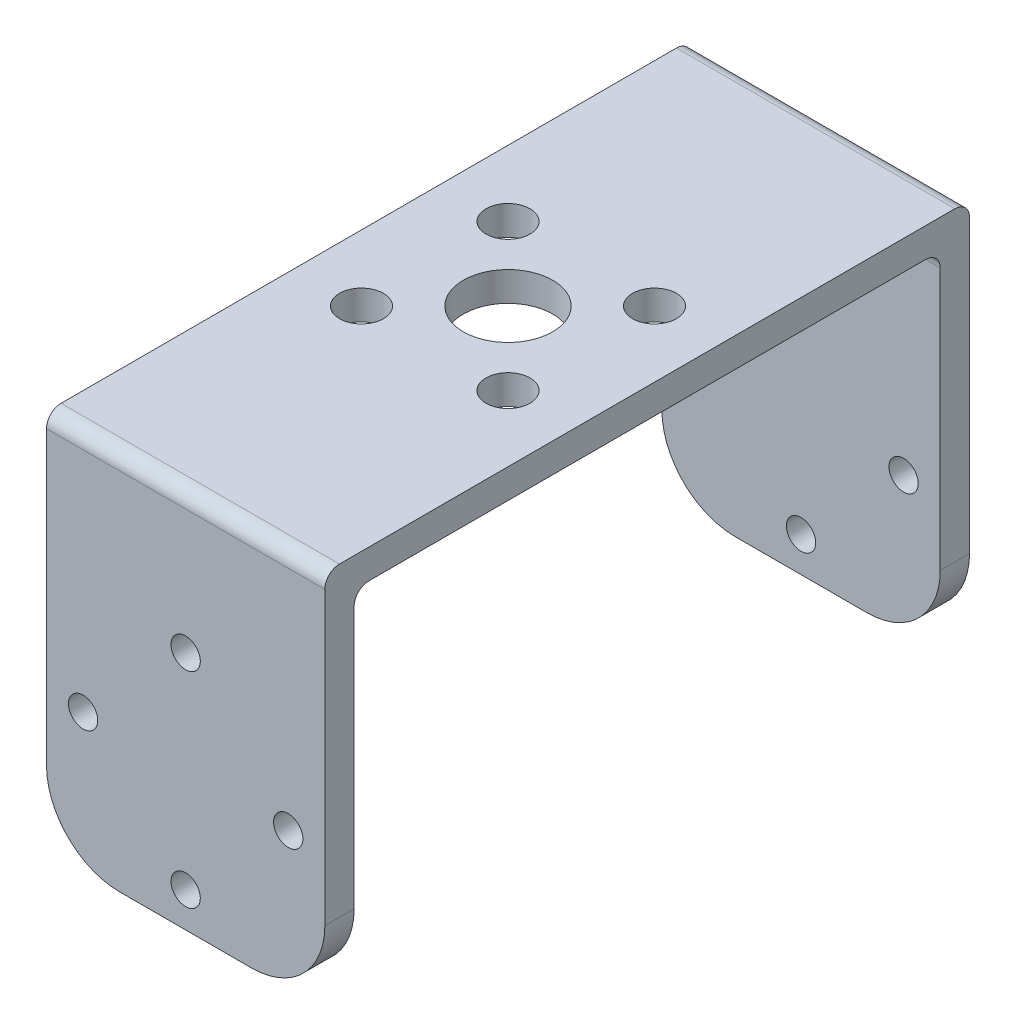
from build123d import *

# Parameters (mm, degrees)
EXTRUDE_1_DEPTH     = 19
FILLET_1_R          = 1
SKETCH_2_R          = 1
CUT_EXTRUDE_1_DEPTH = 500000
FILLET_2_R          = 5
FILLET_3_R          = 5
SKETCH_3_R          = 3.05
SKETCH_3_R_2        = 1.5
CUT_EXTRUDE_2_DEPTH = 500


with BuildPart() as part:
    # 草图1 → 凸台-拉伸1 (new body)
    with BuildSketch(Plane(origin=(0, 0, 0), x_dir=(0, 0, -1), z_dir=(1, 0, 0))):
        Polygon((-20, -12.94), (-20, 10.94), (20, 10.94), (20, -12.94), (22, -12.94), (22, 12.94), (-22, 12.94), (-22, -12.94), align=None)
    extrude(amount=EXTRUDE_1_DEPTH)

    # 圆角1
    fillet_1_edges = [part.edges().sort_by_distance(p)[0] for p in [
        (9.5, 10.94, -20),
        (9.5, 10.94, 20),
        (9.5, 12.94, 22),
        (9.5, 12.94, -22),
    ]]
    fillet(fillet_1_edges, radius=FILLET_1_R)

    # 草图2 → 切除-拉伸1 (cut)
    with BuildSketch(Plane.XY.offset(22)):
        with Locations((2.5, -3.56)):
            Circle(SKETCH_2_R)
        with Locations((16.5, -3.56)):
            Circle(SKETCH_2_R)
        with Locations((9.5, -10.56)):
            Circle(SKETCH_2_R)
        with Locations((9.5, 3.44)):
            Circle(SKETCH_2_R)
    extrude(amount=-CUT_EXTRUDE_1_DEPTH, mode=Mode.SUBTRACT)

    # 圆角2
    fillet_2_edges = [part.edges().sort_by_distance(p)[0] for p in [
        (19, -12.94, 21),
        (0, -12.94, 21),
    ]]
    fillet(fillet_2_edges, radius=FILLET_2_R)

    # 圆角3
    fillet_3_edges = [part.edges().sort_by_distance(p)[0] for p in [
        (0, -12.94, -21),
        (19, -12.94, -21),
    ]]
    fillet(fillet_3_edges, radius=FILLET_3_R)

    # 草图3 → 切除-拉伸2 (cut)
    with BuildSketch(Plane(origin=(0, 12.94, 0), x_dir=(1, 0, 0), z_dir=(0, 1, 0))):
        with Locations(Location((9.5, 0, 0), (0, 0, 270))):
            Circle(SKETCH_3_R)
        with Locations(Location((4.5, 5, 0), (0, 0, 270))):
            Circle(SKETCH_3_R_2)
        with Locations(Location((14.5, 5, 0), (0, 0, 270))):
            Circle(SKETCH_3_R_2)
        with Locations(Location((14.5, -5, 0), (0, 0, 270))):
            Circle(SKETCH_3_R_2)
        with Locations(Location((4.5, -5, 0), (0, 0, 270))):
            Circle(SKETCH_3_R_2)
    extrude(amount=-CUT_EXTRUDE_2_DEPTH, mode=Mode.SUBTRACT)


solid = part.part
